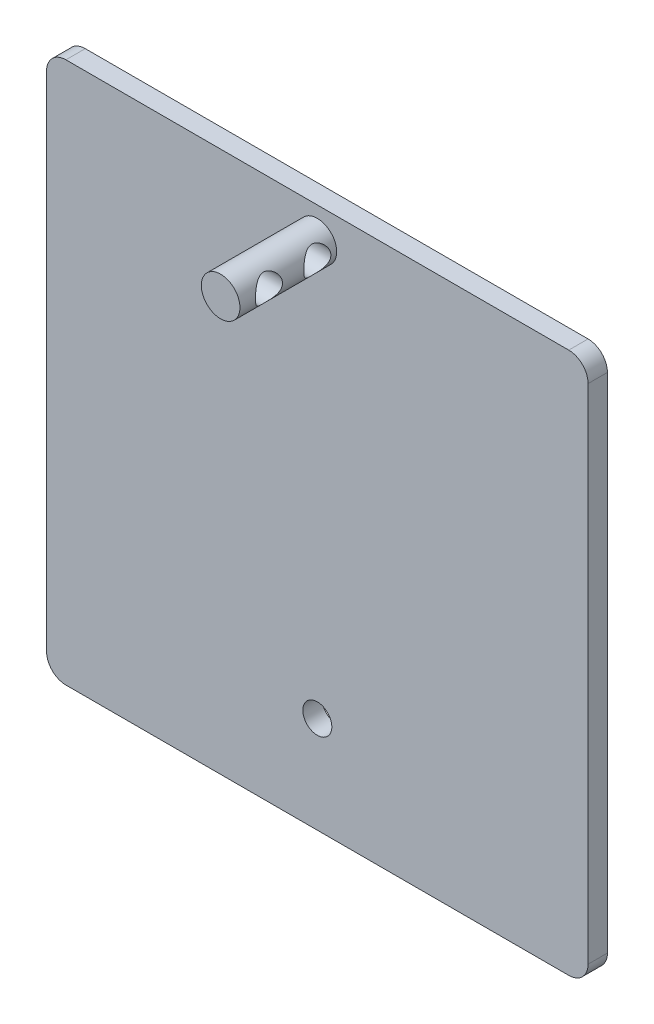
from build123d import *

# Parameters (mm, degrees)
BOSS_EXTRUDE1_DEPTH     = 10
SKETCH2_R               = 7.5
CUT_EXTRUDE1_DEPTH      = 199.242276016
SKETCH3_R               = 10
BOSS_EXTRUDE2_DEPTH     = 60
CUT_EXTRUDE3_DEPTH      = 207.881608656
CUT_EXTRUDE3_DEPTH_BACK = 207.881608656
SKETCH5_R               = 7
BOSS_EXTRUDE3_DEPTH     = 10


with BuildPart() as part:
    # Sketch1 → Boss-Extrude1 (new body)
    with BuildSketch(Plane.XY):
        with BuildLine():
            Line((-130, -140), (130, -140))
            ThreePointArc((130, -140), (137.071067812, -137.071067812), (140, -130))
            Line((140, -130), (140, 130))
            ThreePointArc((140, 130), (137.071067812, 137.071067812), (130, 140))
            Line((130, 140), (-130, 140))
            ThreePointArc((-130, 140), (-137.071067812, 137.071067812), (-140, 130))
            Line((-140, 130), (-140, -130))
            ThreePointArc((-140, -130), (-137.071067812, -137.071067812), (-130, -140))
        make_face()
    extrude(amount=BOSS_EXTRUDE1_DEPTH)

    # Sketch2 → Cut-Extrude1 (cut, through all)
    with BuildSketch(Plane.XY.offset(10)):
        with Locations((0, -90)):
            Circle(SKETCH2_R)
    extrude(amount=-CUT_EXTRUDE1_DEPTH, mode=Mode.SUBTRACT)

    # Sketch3 → Boss-Extrude2 (add)
    with BuildSketch(Plane(origin=(0, 0, 0), x_dir=(-1, 0, 0), z_dir=(0, 0, -1))):
        with Locations((0, 124)):
            Circle(SKETCH3_R)
    extrude(amount=-BOSS_EXTRUDE2_DEPTH)

    # Sketch5 → Cut-Extrude3 (cut, two sides: drawn at the far end of the back side and taken through both)
    with BuildSketch(Plane(origin=(0, 0, 0), x_dir=(0, 0, -1), z_dir=(1, 0, 0)).offset(-CUT_EXTRUDE3_DEPTH_BACK)):
        with Locations((-20, 124)):
            Circle(SKETCH5_R)
        with Locations((-45, 124)):
            Circle(SKETCH5_R)
    extrude(amount=CUT_EXTRUDE3_DEPTH + CUT_EXTRUDE3_DEPTH_BACK, mode=Mode.SUBTRACT)

    # Sketch8 → Boss-Extrude3 (add)
    # profile 1 of 6: a face of its own
    with BuildSketch(Plane.XY):
        Polygon((80.726266852, -4.270349153), (76.110882236, -4.270349153), (76.110882236, -8.116502999), (67.649343775, -8.116502999), (67.649343775, -4.270349153), (63.033959159, -4.270349153), (63.033959159, -14.270349153), (67.649343775, -14.270349153), (67.649343775, -9.911374794), (76.110882236, -9.911374794), (76.110882236, -14.270349153), (80.726266852, -14.270349153), align=None)
    # profile 2 of 6: a face of its own
    with BuildSketch(Plane.XY):
        Polygon((49.84285339, -4.270349153), (45.065209159, -4.270349153), (35.533959159, -14.270349153), (40.481875826, -14.270349153), (42.400946339, -12.219067102), (52.515129031, -12.219067102), (54.436202749, -14.270349153), (59.380113006, -14.270349153), align=None)
        Polygon((47.457036083, -6.95264082), (50.832436724, -10.424195307), (44.081635441, -10.424195307), align=None, mode=Mode.SUBTRACT)
    # profile 3 of 6: a face of its own
    with BuildSketch(Plane.XY):
        with BuildLine():
            Line((9.316010441, -6.005124794), (12.605273262, -7.263137615))
            add(Edge.make_bspline(
                [(12.605273262, -7.263137615), (12.887808251, -7.146359442), (13.456296115, -6.911390405), (14.336425732, -6.616854411), (15.243214187, -6.369166881), (16.174598424, -6.161213381), (17.133994094, -6.004746749), (18.11853414, -5.890566769), (19.129361309, -5.820734187), (19.812026654, -5.812816099), (20.157356595, -5.808810692)],
                knots=[0, 0, 0, 0, 0.947193213, 1.905844825, 2.873724754, 3.859265827, 4.861802634, 5.884645806, 6.929936687, 8, 8, 8, 8], degree=3))
            add(Edge.make_bspline(
                [(20.157356595, -5.808810692), (20.446543458, -5.811974093), (21.013940265, -5.818180821), (21.847397992, -5.864308295), (22.645961949, -5.942471767), (23.410315608, -6.049283935), (24.139606514, -6.189597178), (24.8348653, -6.358897422), (25.494204772, -6.56132094), (26.018080147, -6.755358794), (26.412557817, -6.925058736), (26.688549422, -7.051931693), (26.942554054, -7.187457829), (27.179923379, -7.323045427), (27.398436444, -7.462696129), (27.597557648, -7.607459777), (27.777703673, -7.755076061), (27.939368246, -7.905971228), (28.082148724, -8.060517481), (28.207186919, -8.218543791), (28.312214012, -8.381406396), (28.396788957, -8.548860963), (28.462915184, -8.719366331), (28.512111291, -8.892832739), (28.540534692, -9.070426159), (28.544690037, -9.190123713), (28.546779672, -9.250317102)],
                knots=[0, 0, 0, 0, 2.138342635, 4.19551833, 6.170092571, 8.07011659, 9.900332525, 11.659536693, 13.358829244, 14.99776058, 15.787435926, 16.534058111, 17.243045573, 17.915501509, 18.555124707, 19.159551435, 19.73486048, 20.276309822, 20.79346229, 21.289315625, 21.764582996, 22.223885317, 22.674100666, 23.114958876, 23.554931383, 24, 24, 24, 24], degree=3))
            add(Edge.make_bspline(
                [(28.546779672, -9.250317102), (28.544196077, -9.334112352), (28.539059699, -9.500703464), (28.4822339, -9.745018395), (28.40204618, -9.98428572), (28.280734047, -10.213086443), (28.129287039, -10.436429265), (27.940622385, -10.649008233), (27.723637872, -10.859843577), (27.470432399, -11.05808094), (27.18749049, -11.248133781), (26.876396759, -11.427639649), (26.538259273, -11.598714963), (26.172227047, -11.757992815), (25.77756569, -11.906410586), (25.355484738, -12.043595813), (24.905760193, -12.171651593), (24.431000498, -12.289951102), (23.934630352, -12.391685501), (23.423443404, -12.485480002), (22.898060539, -12.560698894), (22.358869617, -12.621985094), (21.806664939, -12.673453345), (21.240702645, -12.705456666), (20.661707289, -12.729709646), (20.270898734, -12.731156018), (20.07322198, -12.731887615)],
                knots=[0, 0, 0, 0, 0.609913583, 1.212552994, 1.820831625, 2.445874408, 3.094156158, 3.784470815, 4.514548084, 5.297832066, 6.125706884, 6.998461676, 7.915257588, 8.887774692, 9.907923107, 10.988896081, 12.123276148, 13.317259355, 14.555883651, 15.817608268, 17.106725777, 18.425249127, 19.77469078, 21.150339319, 22.558599431, 24, 24, 24, 24], degree=3))
            add(Edge.make_bspline(
                [(20.07322198, -12.731887615), (19.739273463, -12.727992145), (19.084880558, -12.720358729), (18.125604243, -12.66210908), (17.210528681, -12.564286722), (16.473639076, -12.450211607), (15.895447298, -12.33523281), (15.456651178, -12.229122712), (15.006007287, -12.111988909), (14.545308947, -11.977032524), (14.073952953, -11.827407551), (13.594016573, -11.657665828), (13.101952865, -11.476054201), (12.772582646, -11.344424373), (12.605273262, -11.277560692)],
                knots=[0, 0, 0, 0, 1.568713013, 3.07399079, 4.512605481, 5.890585133, 6.575277236, 7.281335722, 8.010976953, 8.762428499, 9.536207509, 10.33381839, 11.153633805, 12, 12, 12, 12], degree=3))
            Line((12.605273262, -11.277560692), (9.416170698, -12.617704922))
            add(Edge.make_bspline(
                [(9.416170698, -12.617704922), (9.641475724, -12.704877996), (10.08759289, -12.877485793), (10.755554305, -13.115254809), (11.414571639, -13.331538674), (12.063027592, -13.531128835), (12.703107491, -13.707095286), (13.334079599, -13.86094129), (13.954056019, -13.998619092), (14.571039628, -14.112772365), (15.193486908, -14.212293396), (15.83229287, -14.295131701), (16.492671865, -14.368305217), (17.174777552, -14.424933923), (17.877945018, -14.471891568), (18.602655072, -14.502708258), (19.348600966, -14.524000301), (19.853521469, -14.525831732), (20.109279672, -14.52675941)],
                knots=[0, 0, 0, 0, 1.060285514, 2.099427503, 3.111480933, 4.104380506, 5.07703436, 6.024553469, 6.95468501, 7.864037787, 8.77805881, 9.721034527, 10.691004545, 11.69399576, 12.724893045, 13.783930287, 14.877490602, 16, 16, 16, 16], degree=3))
            add(Edge.make_bspline(
                [(20.109279672, -14.52675941), (20.345671518, -14.525681944), (20.813182873, -14.523551044), (21.506349723, -14.504279485), (22.18359434, -14.477246999), (22.844115895, -14.437149955), (23.488643428, -14.385297017), (24.116296879, -14.320611338), (24.728479093, -14.248121265), (25.32318505, -14.158477538), (25.902606567, -14.061634342), (26.465334068, -13.950405715), (27.013109358, -13.831951279), (27.543496225, -13.696294497), (28.058435468, -13.553443937), (28.55660522, -13.39639501), (29.038178189, -13.228522444), (29.502346326, -13.05139553), (29.94294396, -12.863451438), (30.358470462, -12.670772138), (30.742832765, -12.467144693), (31.101206913, -12.261780693), (31.430649333, -12.047566503), (31.730478966, -11.824735878), (32.005318816, -11.599483472), (32.247824777, -11.363854071), (32.463860956, -11.124158309), (32.648445084, -10.875661561), (32.809219717, -10.62346825), (32.936943172, -10.361518312), (33.039052087, -10.094395197), (33.107656367, -9.819828919), (33.155040836, -9.539748192), (33.159776232, -9.350008866), (33.162164288, -9.254323512)],
                knots=[0, 0, 0, 0, 1.496408369, 2.959441776, 4.389389617, 5.786855947, 7.148163471, 8.482313102, 9.780997033, 11.050115295, 12.28914997, 13.499472509, 14.680982517, 15.836382257, 16.964545354, 18.063465334, 19.142275792, 20.192621269, 21.207776842, 22.17406724, 23.091090398, 23.960382068, 24.788106249, 25.576878986, 26.324291713, 27.035758382, 27.715358029, 28.364624321, 28.993253275, 29.605744053, 30.206348683, 30.799951206, 31.394816587, 32, 32, 32, 32], degree=3))
            add(Edge.make_bspline(
                [(33.162164288, -9.254323512), (33.157141895, -9.131061645), (33.147104792, -8.884726433), (33.06623121, -8.522066451), (32.933462639, -8.170834028), (32.749905614, -7.830314055), (32.511020185, -7.502852742), (32.226291404, -7.182044759), (31.882793991, -6.878447296), (31.492261699, -6.582728251), (31.053540863, -6.299147165), (30.567815442, -6.031400723), (30.038868148, -5.774455602), (29.462742529, -5.535751431), (28.843047934, -5.309652301), (28.178672822, -5.097555223), (27.469483613, -4.900173891), (26.720539118, -4.717315402), (25.941660788, -4.551992277), (25.142618629, -4.408046603), (24.328936715, -4.28617306), (23.500751973, -4.185063506), (22.657457813, -4.110822447), (21.799313557, -4.053277151), (20.926155246, -4.021911467), (20.339002762, -4.01660998), (20.043173903, -4.013938897)],
                knots=[0, 0, 0, 0, 0.585081979, 1.1692691, 1.755459149, 2.364279631, 3.000699533, 3.676877023, 4.397844828, 5.17433537, 6.002222083, 6.876863707, 7.807475998, 8.794177482, 9.837771564, 10.940188126, 12.106118595, 13.333929643, 14.601772046, 15.887795082, 17.190035142, 18.509589536, 19.850382441, 21.210851904, 22.594725353, 24, 24, 24, 24], degree=3))
            add(Edge.make_bspline(
                [(20.043173903, -4.013938897), (19.790749502, -4.015449379), (19.287789914, -4.018459039), (18.536433715, -4.043614798), (17.791589086, -4.082312215), (17.05446866, -4.142133846), (16.324773938, -4.212273326), (15.603167629, -4.304415391), (14.887382764, -4.40683216), (14.181686501, -4.529615021), (13.490711561, -4.664234756), (12.822327828, -4.814965731), (12.177064622, -4.976201324), (11.557597442, -5.1549706), (10.96121422, -5.344605332), (10.390052708, -5.549275624), (9.842080666, -5.766181459), (9.489677053, -5.92624468), (9.316010441, -6.005124794)],
                knots=[0, 0, 0, 0, 1.102489633, 2.196727936, 3.283223857, 4.359814399, 5.42659098, 6.484693118, 7.536862092, 8.584510431, 9.612914607, 10.611274211, 11.576808362, 12.517438549, 13.426864779, 14.309690288, 15.167005249, 16, 16, 16, 16], degree=3))
        make_face()
    # profile 4 of 6: a face of its own
    with BuildSketch(Plane.XY):
        Polygon((5.213446339, -4.270349153), (0.598061724, -4.270349153), (0.598061724, -7.703842743), (-6.202819687, -4.270349153), (-11.948011994, -4.270349153), (-3.185992764, -8.693426076), (-12.799374174, -14.270349153), (-7.336633789, -14.270349153), (0.598061724, -9.666983768), (0.598061724, -14.270349153), (5.213446339, -14.270349153), align=None)
    # profile 5 of 6: a face of its own
    with BuildSketch(Plane.XY):
        with BuildLine():
            add(Edge.make_bspline(
                [(-37.336633789, -4.013938897), (-37.55165709, -4.015078159), (-37.978440929, -4.017339398), (-38.612913183, -4.035886951), (-39.236041438, -4.065663789), (-39.847163834, -4.107641319), (-40.44692376, -4.161767569), (-41.035379656, -4.227591999), (-41.61309925, -4.305890431), (-42.178932758, -4.39545673), (-42.733245637, -4.498073709), (-43.275717709, -4.611828551), (-43.807352735, -4.73833899), (-44.327823532, -4.876158057), (-44.836857179, -5.026403997), (-45.333911801, -5.188574201), (-45.819475415, -5.363187317), (-46.291035989, -5.548331733), (-46.743445851, -5.740332847), (-47.167896998, -5.941160571), (-47.564861664, -6.14454478), (-47.929674171, -6.357580329), (-48.269075081, -6.570436235), (-48.575219199, -6.794017339), (-48.854437917, -7.01950054), (-49.1053629, -7.250579685), (-49.32454802, -7.488622891), (-49.518402889, -7.72973972), (-49.677925328, -7.979261432), (-49.812511011, -8.232272238), (-49.91437721, -8.492095243), (-49.989697683, -8.756112663), (-50.035395531, -9.026365005), (-50.040432604, -9.208744759), (-50.042963917, -9.30039723)],
                knots=[0, 0, 0, 0, 1.398215043, 2.775213569, 4.127174675, 5.454648844, 6.75821758, 8.042809867, 9.304746779, 10.548997367, 11.767703423, 12.970157833, 14.152882469, 15.320905834, 16.470872435, 17.603693131, 18.720320742, 19.825791003, 20.897664046, 21.915456876, 22.878707215, 23.796985734, 24.661847646, 25.482606844, 26.260435805, 26.994763418, 27.698410483, 28.362977908, 29.00372745, 29.621343621, 30.22365956, 30.814726896, 31.404357082, 32, 32, 32, 32], degree=3))
            add(Edge.make_bspline(
                [(-50.042963917, -9.30039723), (-50.040446952, -9.390725823), (-50.035419987, -9.57113304), (-49.989169302, -9.83836736), (-49.916633935, -10.100705202), (-49.816248469, -10.358278765), (-49.685080669, -10.610004459), (-49.522594008, -10.854095222), (-49.336314756, -11.096112543), (-49.11851698, -11.330755216), (-48.870519426, -11.558450362), (-48.595931943, -11.783918928), (-48.290173359, -12.000272437), (-47.958947231, -12.216847775), (-47.596458679, -12.422916593), (-47.206183522, -12.625924902), (-46.787493501, -12.824367183), (-46.341064832, -13.014221393), (-45.875482133, -13.198503609), (-45.393532641, -13.367515382), (-44.901007502, -13.528469138), (-44.395320835, -13.676840948), (-43.877423648, -13.81227112), (-43.347228392, -13.93730445), (-42.804454368, -14.048122771), (-42.249917469, -14.151894369), (-41.682325389, -14.238055649), (-41.103016748, -14.318188331), (-40.510844522, -14.37993434), (-39.906712318, -14.436085632), (-39.290022139, -14.474212096), (-38.661003635, -14.505034297), (-38.019835589, -14.523320327), (-37.588381104, -14.525606106), (-37.370688276, -14.52675941)],
                knots=[0, 0, 0, 0, 0.589127667, 1.17662503, 1.764494049, 2.363373766, 2.977380118, 3.613178229, 4.274813506, 4.968730122, 5.699597999, 6.47077656, 7.28591908, 8.142961178, 9.05270952, 10.005888764, 11.01373999, 12.075818407, 13.171589538, 14.281182955, 15.408529906, 16.553131124, 17.720121646, 18.901950044, 20.107934701, 21.335405971, 22.583552945, 23.854446979, 25.151947325, 26.468988454, 27.814096019, 29.184085494, 30.579214236, 32, 32, 32, 32], degree=3))
            add(Edge.make_bspline(
                [(-37.370688276, -14.52675941), (-37.14297733, -14.525646963), (-36.692157532, -14.523444553), (-36.022986624, -14.504621647), (-35.368365746, -14.475887239), (-34.728722876, -14.43041451), (-34.103488404, -14.377189978), (-33.49220269, -14.311589134), (-32.895807377, -14.231422416), (-32.314327714, -14.138393937), (-31.747326161, -14.0380223), (-31.195294826, -13.920502602), (-30.657362985, -13.793204457), (-30.134243179, -13.65308916), (-29.626075808, -13.50015435), (-29.132062971, -13.336806147), (-28.652479948, -13.16013366), (-28.190263314, -12.972857524), (-27.748975689, -12.777828254), (-27.334690557, -12.576000383), (-26.949231795, -12.369318635), (-26.591417207, -12.159588226), (-26.262810772, -11.943116298), (-25.96159955, -11.722917227), (-25.688412691, -11.499216896), (-25.444442202, -11.269974248), (-25.229269268, -11.036241084), (-25.044425037, -10.796048277), (-24.884369713, -10.554321223), (-24.755374493, -10.305748044), (-24.653743836, -10.053097477), (-24.584879299, -9.794589876), (-24.53735742, -9.532509226), (-24.532556142, -9.355362493), (-24.530143405, -9.266342743)],
                knots=[0, 0, 0, 0, 1.469074199, 2.908458047, 4.318645155, 5.69615143, 7.045261166, 8.366860047, 9.662148129, 10.927078095, 12.16587195, 13.376625787, 14.567816154, 15.731932626, 16.869962303, 17.991135488, 19.088315172, 20.166685033, 21.208153746, 22.200390341, 23.139023484, 24.029315026, 24.875257944, 25.676586456, 26.435571823, 27.151744908, 27.834771964, 28.48275978, 29.105287353, 29.702605515, 30.286585601, 30.858248349, 31.426247129, 32, 32, 32, 32], degree=3))
            add(Edge.make_bspline(
                [(-24.530143405, -9.266342743), (-24.535026132, -9.147705961), (-24.544820796, -8.909722655), (-24.629020812, -8.557771397), (-24.76489697, -8.214400588), (-24.954611316, -7.879476566), (-25.194922299, -7.551186156), (-25.491049176, -7.232193974), (-25.838941594, -6.919941501), (-26.238455482, -6.617699325), (-26.681504154, -6.323159662), (-27.170275815, -6.049102416), (-27.696204738, -5.785123945), (-28.263364972, -5.540296937), (-28.870021025, -5.310405786), (-29.51499253, -5.093339225), (-30.20152418, -4.896776773), (-30.922948455, -4.71350664), (-31.670928611, -4.547734922), (-32.43832447, -4.406702992), (-33.218852398, -4.28303381), (-34.014888887, -4.186905885), (-34.824877228, -4.106791757), (-35.649428189, -4.055254238), (-36.488273684, -4.018372674), (-37.052136708, -4.015425761), (-37.336633789, -4.013938897)],
                knots=[0, 0, 0, 0, 0.575516203, 1.154475423, 1.747015557, 2.36403712, 3.018482295, 3.718477466, 4.473875707, 5.285896503, 6.149307832, 7.055503786, 8.005391704, 9.006026481, 10.053942852, 11.155282059, 12.309840035, 13.521039365, 14.769674026, 16.029626609, 17.309682872, 18.606831164, 19.923000117, 21.26188694, 22.618485089, 24, 24, 24, 24], degree=3))
        make_face()
        with BuildLine():
            add(Edge.make_bspline(
                [(-37.27052802, -5.808810692), (-36.989342901, -5.811873285), (-36.438605487, -5.81787177), (-35.629358173, -5.865298344), (-34.854449771, -5.939376731), (-34.113240152, -6.048189015), (-33.40634468, -6.185320892), (-32.733163944, -6.352985041), (-32.095009742, -6.553157985), (-31.589389722, -6.746958491), (-31.206349368, -6.911810777), (-30.942374039, -7.04349941), (-30.694329174, -7.174515492), (-30.466233852, -7.313227131), (-30.255193008, -7.455042001), (-30.063154596, -7.601555958), (-29.887068521, -7.749691159), (-29.730622699, -7.903443036), (-29.594023254, -8.063289254), (-29.472703011, -8.224596022), (-29.371626759, -8.392516909), (-29.289827928, -8.56454515), (-29.224952878, -8.740085738), (-29.17783416, -8.919701017), (-29.152430507, -9.104024839), (-29.147830665, -9.228213382), (-29.14552802, -9.290381204)],
                knots=[0, 0, 0, 0, 2.12257129, 4.157330322, 6.117512151, 7.997389224, 9.810475971, 11.551430507, 13.231803632, 14.856061038, 15.637112744, 16.378799825, 17.082442222, 17.754159611, 18.393093135, 19.001030249, 19.576766845, 20.129260802, 20.654692973, 21.162817337, 21.651257609, 22.131513788, 22.598790568, 23.062162954, 23.530526046, 24, 24, 24, 24], degree=3))
            add(Edge.make_bspline(
                [(-29.14552802, -9.290381204), (-29.147967875, -9.359957398), (-29.152806546, -9.497939485), (-29.1877748, -9.702490548), (-29.246448345, -9.9010785), (-29.32670139, -10.095084286), (-29.432207352, -10.281732752), (-29.559716319, -10.463481195), (-29.709842065, -10.639304888), (-29.884326016, -10.808608164), (-30.081433153, -10.972003534), (-30.299407743, -11.133474154), (-30.543668898, -11.284073511), (-30.808181178, -11.433404318), (-31.096984771, -11.574527132), (-31.40828875, -11.711163168), (-31.742976575, -11.840700262), (-31.975134128, -11.921302622), (-32.094245969, -11.962656845)],
                knots=[0, 0, 0, 0, 0.785823833, 1.558429782, 2.336613125, 3.121132445, 3.924891026, 4.753607452, 5.625814849, 6.532662391, 7.496573087, 8.51650288, 9.594372591, 10.735904471, 11.947022556, 13.223828916, 14.575644676, 16, 16, 16, 16], degree=3))
            add(Edge.make_bspline(
                [(-32.094245969, -11.962656845), (-32.288663343, -12.024668512), (-32.681541632, -12.14998158), (-33.287758151, -12.304428844), (-33.913885759, -12.437142021), (-34.561594291, -12.544868521), (-35.230562065, -12.628696403), (-35.920168588, -12.688186793), (-36.63042829, -12.725244589), (-37.110893517, -12.729651647), (-37.354662635, -12.731887615)],
                knots=[0, 0, 0, 0, 0.917137332, 1.853349508, 2.810554871, 3.793508824, 4.803919509, 5.840369485, 6.904288598, 8, 8, 8, 8], degree=3))
            add(Edge.make_bspline(
                [(-37.354662635, -12.731887615), (-37.629163867, -12.728735968), (-38.167876956, -12.722550812), (-38.960613862, -12.676147271), (-39.721846846, -12.598274938), (-40.452746735, -12.49093487), (-41.152385992, -12.35145588), (-41.820882093, -12.178670223), (-42.458592971, -11.977113316), (-42.966109658, -11.782585153), (-43.350167765, -11.614335003), (-43.617326515, -11.483710297), (-43.866213001, -11.349844744), (-44.096362722, -11.211415019), (-44.309640677, -11.071449116), (-44.504449656, -10.927968575), (-44.679408905, -10.778260576), (-44.838274842, -10.627296222), (-44.976833325, -10.470961973), (-45.095653744, -10.310834398), (-45.200139045, -10.14907402), (-45.279989141, -9.980111472), (-45.349178543, -9.810684608), (-45.394777306, -9.635597897), (-45.420775351, -9.456762895), (-45.425309687, -9.336536729), (-45.427579302, -9.276358768)],
                knots=[0, 0, 0, 0, 2.091538774, 4.104678535, 6.048251014, 7.920529377, 9.731585311, 11.481458912, 13.179069964, 14.825078971, 15.620133447, 16.373320196, 17.090430771, 17.772783821, 18.419092197, 19.033722734, 19.61484014, 20.172590517, 20.702445009, 21.204116765, 21.691125763, 22.166705136, 22.625889813, 23.08374773, 23.541379433, 24, 24, 24, 24], degree=3))
            add(Edge.make_bspline(
                [(-45.427579302, -9.276358768), (-45.425529917, -9.216156621), (-45.421454614, -9.096441649), (-45.392464262, -8.919151997), (-45.345680045, -8.745584349), (-45.282638761, -8.574791096), (-45.195534363, -8.409358058), (-45.094880518, -8.245328821), (-44.972392196, -8.085966791), (-44.833034169, -7.929935324), (-44.671978197, -7.77993367), (-44.497368136, -7.629109971), (-44.300690935, -7.48500267), (-44.086937591, -7.343033168), (-43.854061143, -7.205048796), (-43.603354091, -7.070869768), (-43.333662524, -6.940750038), (-42.94705776, -6.768853536), (-42.435418831, -6.571756123), (-41.791663786, -6.367545322), (-41.117175295, -6.193004594), (-40.409177606, -6.053955373), (-39.669796633, -5.944432469), (-38.898611785, -5.864015795), (-38.0950748, -5.818259685), (-37.549030879, -5.812002229), (-37.27052802, -5.808810692)],
                knots=[0, 0, 0, 0, 0.454806557, 0.904405503, 1.353579563, 1.811843503, 2.27669873, 2.763934824, 3.264470052, 3.793274737, 4.342900656, 4.926298063, 5.53581717, 6.1837431, 6.864753057, 7.580343045, 8.33180257, 9.126900975, 10.776974883, 12.471614218, 14.227738436, 16.038576888, 17.92098077, 19.874002952, 21.895586911, 24, 24, 24, 24], degree=3))
        make_face(mode=Mode.SUBTRACT)
    # profile 6 of 6: a face of its own
    with BuildSketch(Plane.XY):
        Polygon((-54.530143405, -4.270349153), (-58.917162635, -4.270349153), (-69.658348533, -10.850877999), (-69.658348533, -4.270349153), (-74.273733148, -4.270349153), (-74.273733148, -14.270349153), (-69.856665841, -14.270349153), (-59.14552802, -7.709852358), (-59.14552802, -14.270349153), (-54.530143405, -14.270349153), align=None)
    extrude(amount=-BOSS_EXTRUDE3_DEPTH)


solid = part.part
